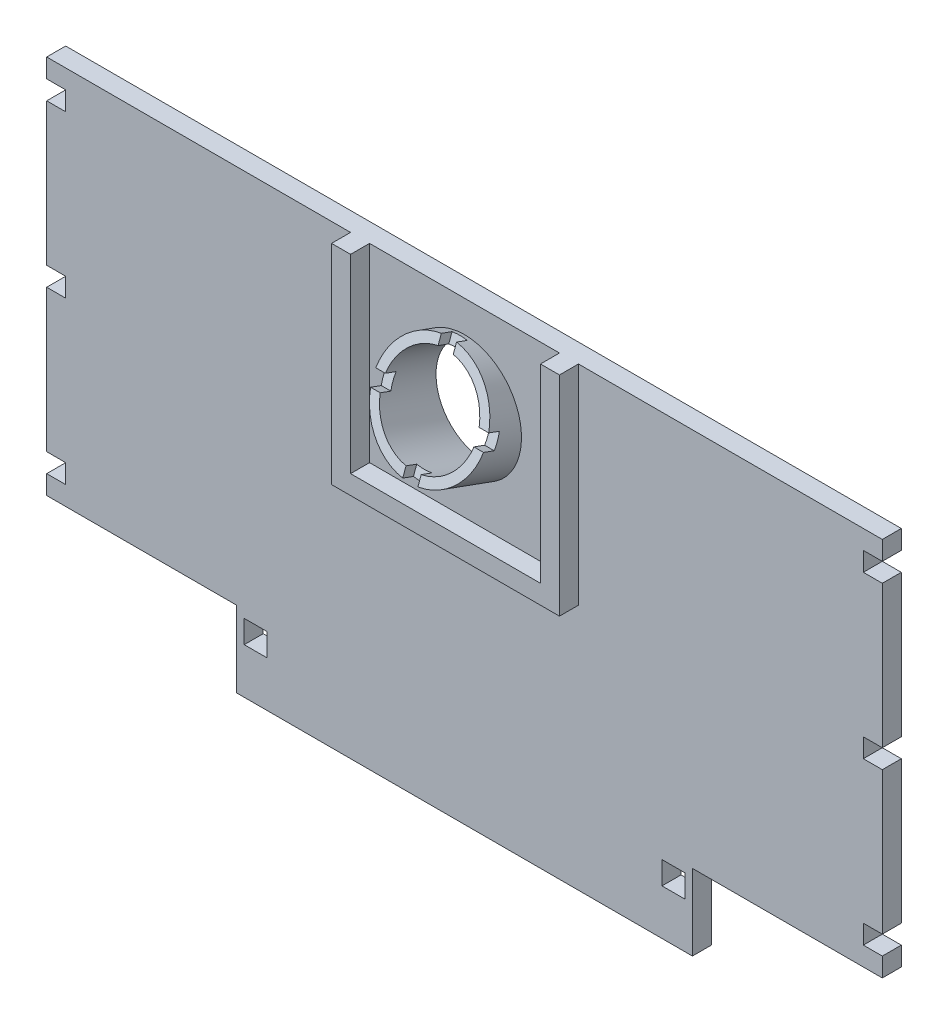
from build123d import *

# Parameters (mm, degrees)
SKETCH2_W            = 6
SKETCH2_H            = 6
BOSS_EXTRUDE1_DEPTH  = 5
SKETCH3_W            = 200
SKETCH3_H            = 20
CUT_EXTRUDE1_DEPTH   = 5
SKETCH6_W            = 100
SKETCH6_H            = 20
BOSS_EXTRUDE2_DEPTH  = 100
BOSS_EXTRUDE3_DEPTH  = 100
CUT_EXTRUDE4_DEPTH   = 100
BOSS_EXTRUDE5_DEPTH  = 100
SKETCH14_R           = 12.5
CUT_EXTRUDE5_DEPTH   = 100
SKETCH15_R           = 15
SKETCH15_R_2         = 12.5
BOSS_EXTRUDE6_DEPTH  = 40
SKETCH16_W           = 50
SKETCH16_H           = 61.072294376
CUT_EXTRUDE10_DEPTH  = 35
SKETCH15_4_R         = 15
SKETCH15_4_R_2       = 12.5
CUT_EXTRUDE11_DEPTH  = 15
BOSS_EXTRUDE7_DEPTH  = 5
SKETCH23_R           = 15
SKETCH23_R_2         = 12.5
BOSS_EXTRUDE8_DEPTH  = 25
SKETCH21_W           = 50
SKETCH21_H           = 55
CUT_EXTRUDE12_DEPTH  = 35
SKETCH22_W           = 50
SKETCH22_H           = 55
BOSS_EXTRUDE9_DEPTH  = 5
SKETCH23_3_R         = 12.5
CUT_EXTRUDE13_DEPTH  = 20
CUT_EXTRUDE15_DEPTH  = 3
CUT_EXTRUDE16_DEPTH  = 5
SKETCH28_3_W         = 50
SKETCH28_3_H         = 5
BOSS_EXTRUDE12_DEPTH = 5
SKETCH30_W           = 200
SKETCH30_H           = 120
CUT_EXTRUDE17_DEPTH  = 100
BOSS_EXTRUDE13_DEPTH = 5


with BuildPart() as part:
    # Sketch2 → Boss-Extrude1 (new body)
    with BuildSketch(Plane.XY):
        Polygon((-100, 75), (-100, -45), (-60, -45), (-60, -65), (0, -65), (60, -65), (60, -45), (100, -45), (100, 75), align=None)
        with Locations((55, -50)):
            Rectangle(SKETCH2_W, SKETCH2_H, mode=Mode.SUBTRACT)
        with Locations((-55, -50)):
            Rectangle(SKETCH2_W, SKETCH2_H, mode=Mode.SUBTRACT)
    extrude(amount=BOSS_EXTRUDE1_DEPTH)

    # Sketch3 → Cut-Extrude1 (cut)
    with BuildSketch(Plane.XY.offset(5)):
        with Locations((0, 65)):
            Rectangle(SKETCH3_W, SKETCH3_H)
    extrude(amount=-CUT_EXTRUDE1_DEPTH, mode=Mode.SUBTRACT)

    # Sketch6 → Boss-Extrude2 (add)
    with BuildSketch(Plane(origin=(0, 0, 0), x_dir=(-1, 0, 0), z_dir=(0, 0, -1))):
        with Locations((0, -55)):
            Rectangle(SKETCH6_W, SKETCH6_H)
    extrude(amount=BOSS_EXTRUDE2_DEPTH)

    # Sketch8 → Boss-Extrude3 (add)
    with BuildSketch(Plane(origin=(50, 0, 0), x_dir=(0, 0, -1), z_dir=(1, 0, 0))):
        Polygon((42.17911114, -45), (100, -45), (100, 55), (78.57613456, 55), (63.797824283, 14.396926208), (60.37762285, 5), (56.957421417, -4.396926208), align=None)
    extrude(amount=-BOSS_EXTRUDE3_DEPTH)

    # Sketch12 → Cut-Extrude4 (cut)
    with BuildSketch(Plane(origin=(50, 0, 0), x_dir=(0, 0, -1), z_dir=(1, 0, 0))):
        Polygon((78.57613456, 55), (42.17911114, -45), (47.5, -45), (83.89702342, 55), align=None)
    extrude(amount=-CUT_EXTRUDE4_DEPTH, mode=Mode.SUBTRACT)

    # Sketch13 → Boss-Extrude5 (add)
    with BuildSketch(Plane(origin=(0, -20.530205756, -56.406276742), x_dir=(1, 0, 0), z_dir=(0, 0.34202014327073604, 0.9396926208059022))):
        with BuildLine():
            ThreePointArc((10, 27.168677492), (7.071067812, 34.239745304), (0, 37.168677492))
            ThreePointArc((0, 37.168677492), (-7.071067812, 20.09760968), (10, 27.168677492))
        make_face()
    extrude(amount=BOSS_EXTRUDE5_DEPTH)

    # Sketch14 → Cut-Extrude5 (cut)
    with BuildSketch(Plane(origin=(0, 13.671808571, 37.562985339), x_dir=(1, 0, 0), z_dir=(0, 0.3420201432707361, 0.9396926208059023))):
        with Locations((0, 27.168677492)):
            Circle(SKETCH14_R)
    extrude(amount=-CUT_EXTRUDE5_DEPTH, mode=Mode.SUBTRACT)

    # Sketch15 → Boss-Extrude6 (add)
    with BuildSketch(Plane(origin=(0, 13.671808571, 37.562985339), x_dir=(1, 0, 0), z_dir=(0, 0.3420201432707362, 0.9396926208059023))):
        with Locations((0, 27.168677492)):
            Circle(SKETCH15_R)
        with Locations((0, 27.168677492)):
            Circle(SKETCH15_R_2, mode=Mode.SUBTRACT)
    extrude(amount=-BOSS_EXTRUDE6_DEPTH)

    # Sketch16 → Cut-Extrude10 (cut)
    with BuildSketch(Plane(origin=(0, 0, -30), x_dir=(-1, 0, 0), z_dir=(0, 0, -1))):
        with Locations((0, 30.536147188)):
            Rectangle(SKETCH16_W, SKETCH16_H)
    extrude(amount=-CUT_EXTRUDE10_DEPTH, mode=Mode.SUBTRACT)


with BuildPart() as cut_extrude10_piece_1:
    # of the separate pieces the step leaves, piece 1, a body of its own (cut_extrude10_pieces)
    add(part.part.solids().sort_by_distance((-100, 55, 0))[0])

    # Sketch18 → Boss-Extrude7 (add)
    with BuildSketch(Plane.XY.offset(5)):
        Polygon((30, 55), (25, 55), (25, 0), (-25, 0), (-25, 55), (-30, 55), (-30, -5), (30, -5), (30, 0), align=None)
    extrude(amount=BOSS_EXTRUDE7_DEPTH)



with BuildPart() as cut_extrude10_piece_2:
    # of the separate pieces the step leaves, piece 2, a body of its own (cut_extrude10_pieces)
    add(part.part.solids().sort_by_distance((15, 39.202014327, 28.270750371))[0])

    # Sketch15<4> → Cut-Extrude11 (cut)
    with BuildSketch(Plane(origin=(0, 13.671808571, 37.562985339), x_dir=(1, 0, 0), z_dir=(0, 0.3420201432707362, 0.9396926208059023))):
        with Locations((0, 27.168677492)):
            Circle(SKETCH15_4_R)
        with Locations((0, 27.168677492)):
            Circle(SKETCH15_4_R_2, mode=Mode.SUBTRACT)
    extrude(amount=-CUT_EXTRUDE11_DEPTH, mode=Mode.SUBTRACT)

    # Sketch23 → Boss-Extrude8 (add)
    with BuildSketch(Plane(origin=(0, 8.541506422, 23.467596027), x_dir=(1, 0, 0), z_dir=(0, 0.34202014327073627, 0.9396926208059023))):
        with Locations((0, 27.168677492)):
            Circle(SKETCH23_R)
        with Locations((0, 27.168677492)):
            Circle(SKETCH23_R_2, mode=Mode.SUBTRACT)
    extrude(amount=-BOSS_EXTRUDE8_DEPTH)

    # Sketch21 → Cut-Extrude12 (cut)
    with BuildSketch(Plane(origin=(0, 0, -30), x_dir=(-1, 0, 0), z_dir=(0, 0, -1))):
        with Locations((0, 27.5)):
            Rectangle(SKETCH21_W, SKETCH21_H)
    extrude(amount=-CUT_EXTRUDE12_DEPTH, mode=Mode.SUBTRACT)


with BuildPart() as cut_extrude10_piece_1_1:
    add(cut_extrude10_piece_1.part)

    add(cut_extrude10_piece_2.part)  # Boss-Extrude9 merges Cut-Extrude10 piece 2
    # Sketch22 → Boss-Extrude9 (add)
    with BuildSketch(Plane(origin=(0, 0, 0), x_dir=(-1, 0, 0), z_dir=(0, 0, -1))):
        with Locations((0, 27.5)):
            Rectangle(SKETCH22_W, SKETCH22_H)
    extrude(amount=-BOSS_EXTRUDE9_DEPTH)

    # Sketch23<3> → Cut-Extrude13 (cut)
    with BuildSketch(Plane(origin=(0, 8.541506422, 23.467596027), x_dir=(1, 0, 0), z_dir=(0, 0.34202014327073627, 0.9396926208059023))):
        with Locations((0, 27.168677492)):
            Circle(SKETCH23_3_R)
    extrude(amount=-CUT_EXTRUDE13_DEPTH, mode=Mode.SUBTRACT)

    # Sketch27 → Cut-Extrude15 (cut)
    with BuildSketch(Plane(origin=(0, 8.541506422, 23.467596027), x_dir=(1, 0, 0), z_dir=(0, 0.34202014327073627, 0.9396926208059023))):
        with BuildLine():
            ThreePointArc((2, 42.034746239), (0, 42.168677492), (-2, 42.034746239))
            Line((-2, 42.034746239), (-2, 39.507640171))
            ThreePointArc((-2, 39.507640171), (0, 39.668677492), (2, 39.507640171))
            Line((2, 39.507640171), (2, 42.034746239))
        make_face()
        with BuildLine():
            Line((-12.338962679, 29.168677492), (-14.866068747, 29.168677492))
            ThreePointArc((-14.866068747, 29.168677492), (-15, 27.168677492), (-14.866068747, 25.168677492))
            Line((-14.866068747, 25.168677492), (-12.338962679, 25.168677492))
            ThreePointArc((-12.338962679, 25.168677492), (-12.5, 27.168677492), (-12.338962679, 29.168677492))
        make_face()
        with BuildLine():
            ThreePointArc((14.866068747, 25.168677492), (15, 27.168677492), (14.866068747, 29.168677492))
            Line((14.866068747, 29.168677492), (12.338962679, 29.168677492))
            ThreePointArc((12.338962679, 29.168677492), (12.5, 27.168677492), (12.338962679, 25.168677492))
            Line((12.338962679, 25.168677492), (14.866068747, 25.168677492))
        make_face()
        with BuildLine():
            ThreePointArc((2, 14.829714813), (0, 14.668677492), (-2, 14.829714813))
            Line((-2, 14.829714813), (-2, 12.302608744))
            ThreePointArc((-2, 12.302608744), (0, 12.168677492), (2, 12.302608744))
            Line((2, 12.302608744), (2, 14.829714813))
        make_face()
    extrude(amount=-CUT_EXTRUDE15_DEPTH, mode=Mode.SUBTRACT)

    # Sketch28 → Cut-Extrude16 (cut)
    with BuildSketch(Plane.XY.offset(10)):
        Polygon((25, 0), (-25, 0), (-30, 0), (-30, -5), (30, -5), (30, 0), align=None)
    extrude(amount=-CUT_EXTRUDE16_DEPTH, mode=Mode.SUBTRACT)

    # Sketch28<3> → Boss-Extrude12 (add)
    with BuildSketch(Plane.XY.offset(10)):
        with Locations((0, 2.5)):
            Rectangle(SKETCH28_3_W, SKETCH28_3_H)
    extrude(amount=-BOSS_EXTRUDE12_DEPTH)

    # Sketch30 → Cut-Extrude17 (cut)
    with BuildSketch(Plane(origin=(0, 0, -100), x_dir=(-1, 0, 0), z_dir=(0, 0, -1))):
        with Locations((0, -5)):
            Rectangle(SKETCH30_W, SKETCH30_H)
    extrude(amount=-CUT_EXTRUDE17_DEPTH, mode=Mode.SUBTRACT)

    # Sketch31 → Boss-Extrude13 (add)
    with BuildSketch(Plane(origin=(0, 0, 0), x_dir=(-1, 0, 0), z_dir=(0, 0, -1))):
        Polygon((110, 55), (100, 55), (100, -45), (110, -45), (110, -40), (105, -40), (105, -35), (110, -35), (110, 2.5), (105, 2.5), (105, 7.5), (110, 7.5), (110, 45), (105, 45), (105, 50), (110, 50), align=None)
        Polygon((-100, -45), (-100, 55), (-110, 55), (-110, 50), (-105, 50), (-105, 45), (-110, 45), (-110, 7.5), (-105, 7.5), (-105, 2.5), (-110, 2.5), (-110, -35), (-105, -35), (-105, -40), (-110, -40), (-110, -45), align=None)
    extrude(amount=-BOSS_EXTRUDE13_DEPTH)


solid = cut_extrude10_piece_1_1.part
